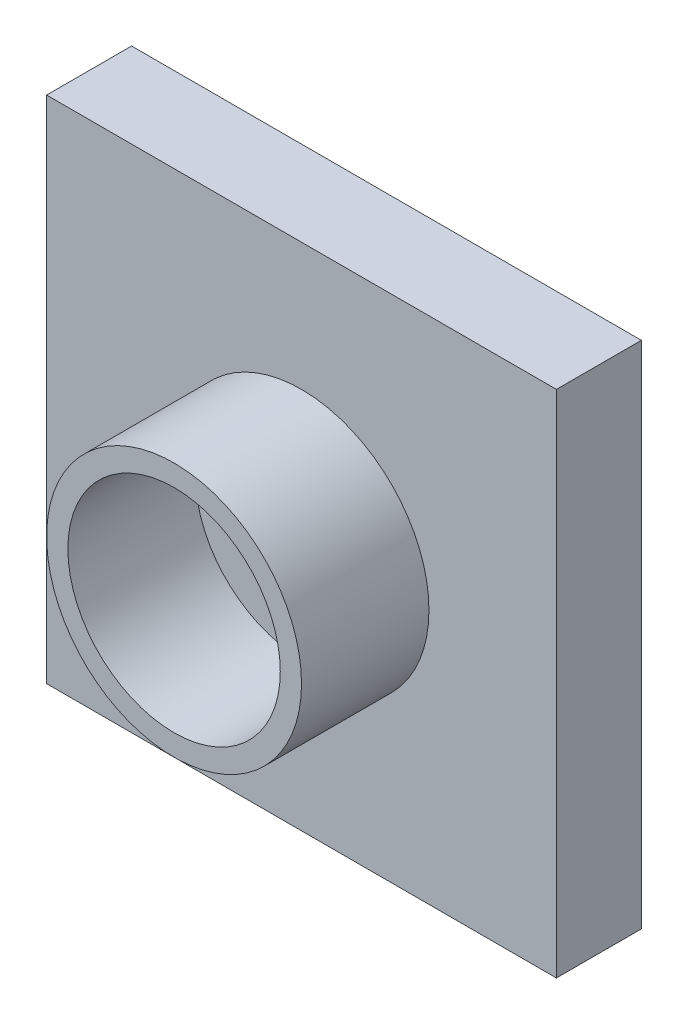
from build123d import *

# Parameters (mm, degrees)
SKETCH1_W           = 12
SKETCH1_H           = 12
BOSS_EXTRUDE1_DEPTH = 2
SKETCH2_R           = 3
SKETCH2_R_2         = 2.5
BOSS_EXTRUDE2_DEPTH = 3
SKETCH5_R           = 1
CUT_EXTRUDE1_DEPTH  = 10


with BuildPart() as part:
    # Sketch1 → Boss-Extrude1 (new body)
    with BuildSketch(Plane.XY):
        Rectangle(SKETCH1_W, SKETCH1_H)
    extrude(amount=BOSS_EXTRUDE1_DEPTH)

    # Sketch2 → Boss-Extrude2 (add)
    with BuildSketch(Plane.XY.offset(2)):
        Circle(SKETCH2_R)
        Circle(SKETCH2_R_2, mode=Mode.SUBTRACT)
    extrude(amount=BOSS_EXTRUDE2_DEPTH)

    # Sketch5 → Cut-Extrude1 (cut, through all)
    with BuildSketch(Plane.XY.offset(2)):
        Circle(SKETCH5_R)
    extrude(amount=-CUT_EXTRUDE1_DEPTH, mode=Mode.SUBTRACT)


solid = part.part
